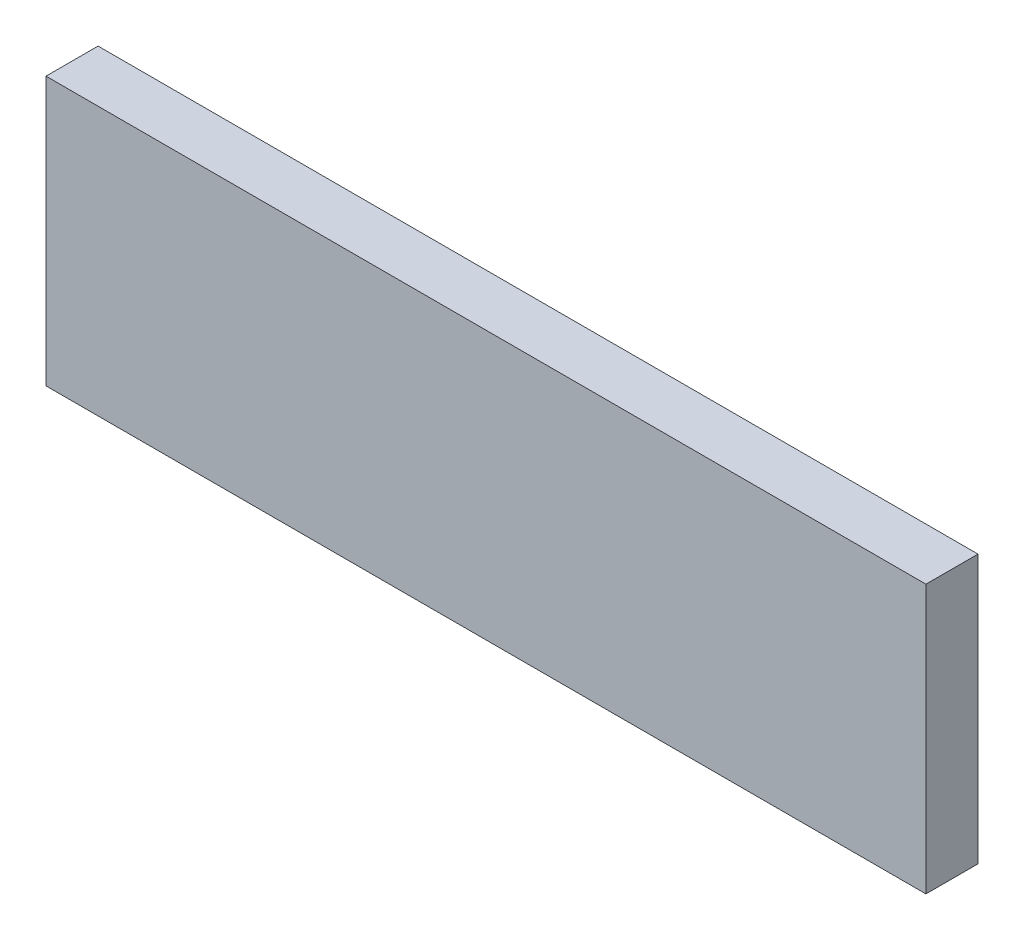
from build123d import *

# Parameters (mm, degrees)
SKETCH1_W           = 42.920186872
SKETCH1_H           = 13.085422827
BOSS_EXTRUDE1_DEPTH = 2.54


with BuildPart() as part:
    # Sketch1 → Boss-Extrude1 (new body)
    with BuildSketch(Plane.XY):
        with Locations((0.924247782, -12.002110783)):
            Rectangle(SKETCH1_W, SKETCH1_H)
    extrude(amount=BOSS_EXTRUDE1_DEPTH)


solid = part.part
